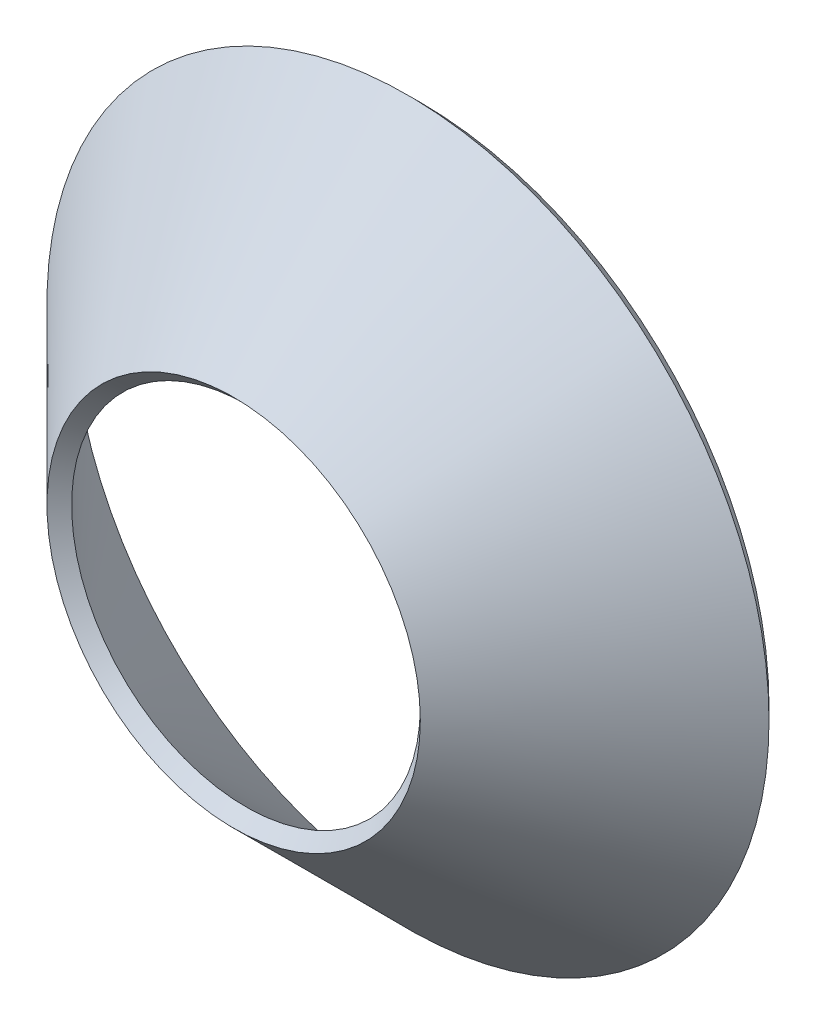
from build123d import *


with BuildPart() as part:
    # Sketch1 → Revolve-Thin1 (revolve)
    with BuildSketch(Plane.YZ, mode=Mode.PRIVATE) as revolve_thin1_sk:
        Polygon((25.4, 25.4), (50.8, 0), (52.596051224, 1.796051224), (27.196051224, 27.196051224), align=None)
    revolve(revolve_thin1_sk.sketch.rotate(Axis((0, 0, 26.67), (0, 0, -1)), 90), axis=Axis((0, 0, 26.67), (0, 0, -1)))


solid = part.part
